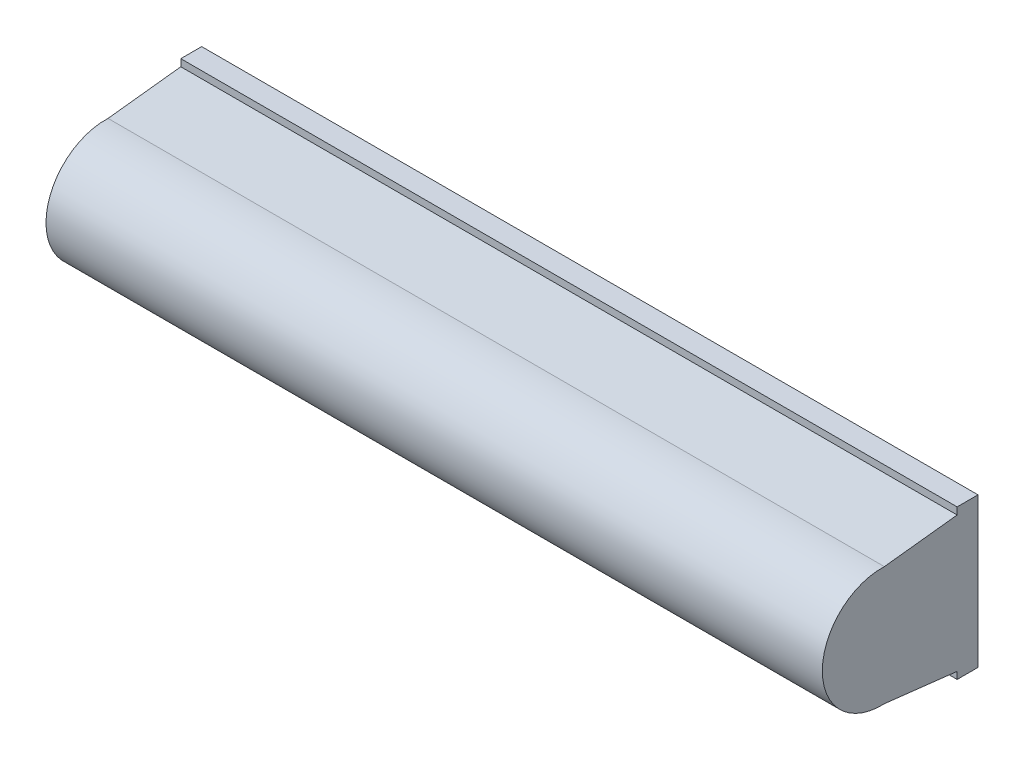
from build123d import *

# Parameters (mm, degrees)
BOSS_EXTRUDE1_DEPTH = 80


with BuildPart() as part:
    # Sketch1 → Boss-Extrude1 (new, symmetric)
    with BuildSketch(Plane(origin=(0, 0, 0), x_dir=(0, 0, -1), z_dir=(1, 0, 0))):
        with BuildLine():
            Line((0, -15.405), (0, 15.405))
            Line((0, 15.405), (-4.3, 15.405))
            Line((-4.3, 15.405), (-4.3, 13.955))
            Line((-4.3, 13.955), (-19.295662505, 12.238340714))
            ThreePointArc((-19.295662505, 12.238340714), (-32.08, 0), (-19.295662505, -12.238340714))
            Line((-19.295662505, -12.238340714), (-4.3, -13.955))
            Line((-4.3, -13.955), (-4.3, -15.405))
            Line((-4.3, -15.405), (0, -15.405))
        make_face()
    extrude(amount=BOSS_EXTRUDE1_DEPTH, both=True)


solid = part.part
